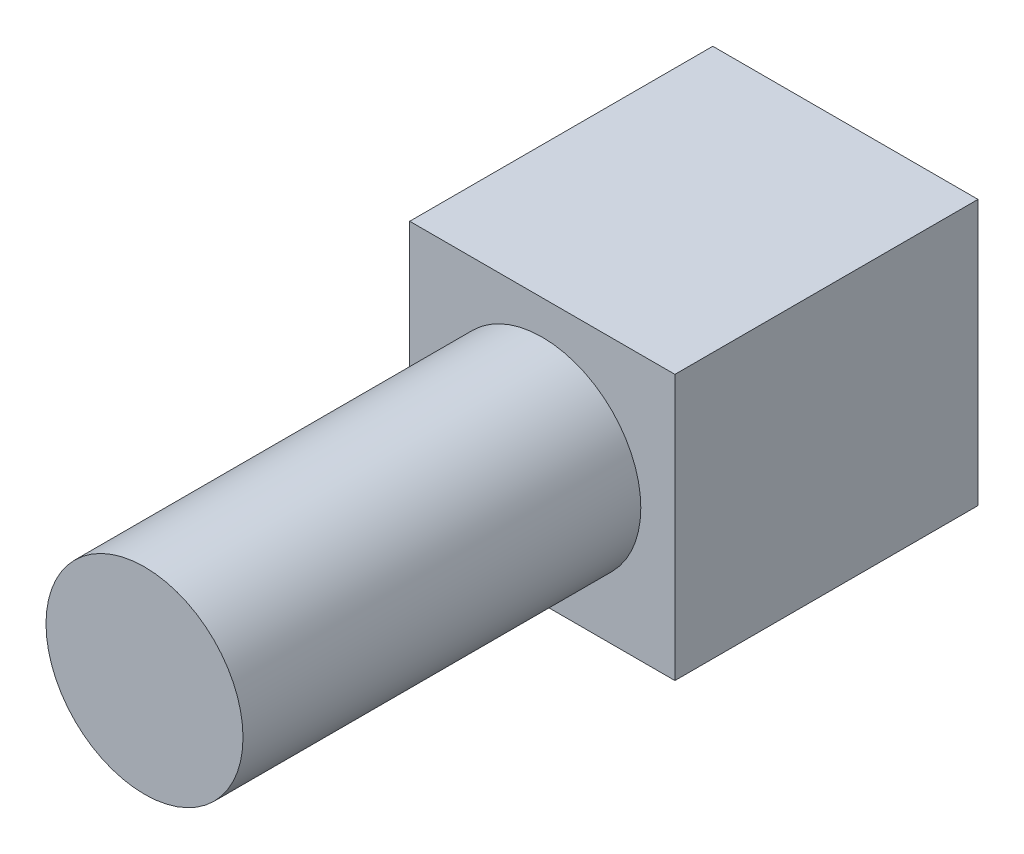
from build123d import *

# Parameters (mm, degrees)
SKETCH_1_W      = 7
SKETCH_1_H      = 7
EXTRUDE_1_DEPTH = 8
SKETCH_2_R      = 2.6
EXTRUDE_2_DEPTH = 10.5


with BuildPart() as part:
    # 草图1 → 凸台-拉伸1 (new body)
    with BuildSketch(Plane.XY):
        Rectangle(SKETCH_1_W, SKETCH_1_H)
    extrude(amount=-EXTRUDE_1_DEPTH)

    # 草图2 → 凸台-拉伸2 (add)
    with BuildSketch(Plane.XY):
        with Locations(Location((0, 0, 0), (0, 0, 180))):
            Circle(SKETCH_2_R)
    extrude(amount=EXTRUDE_2_DEPTH)


solid = part.part
